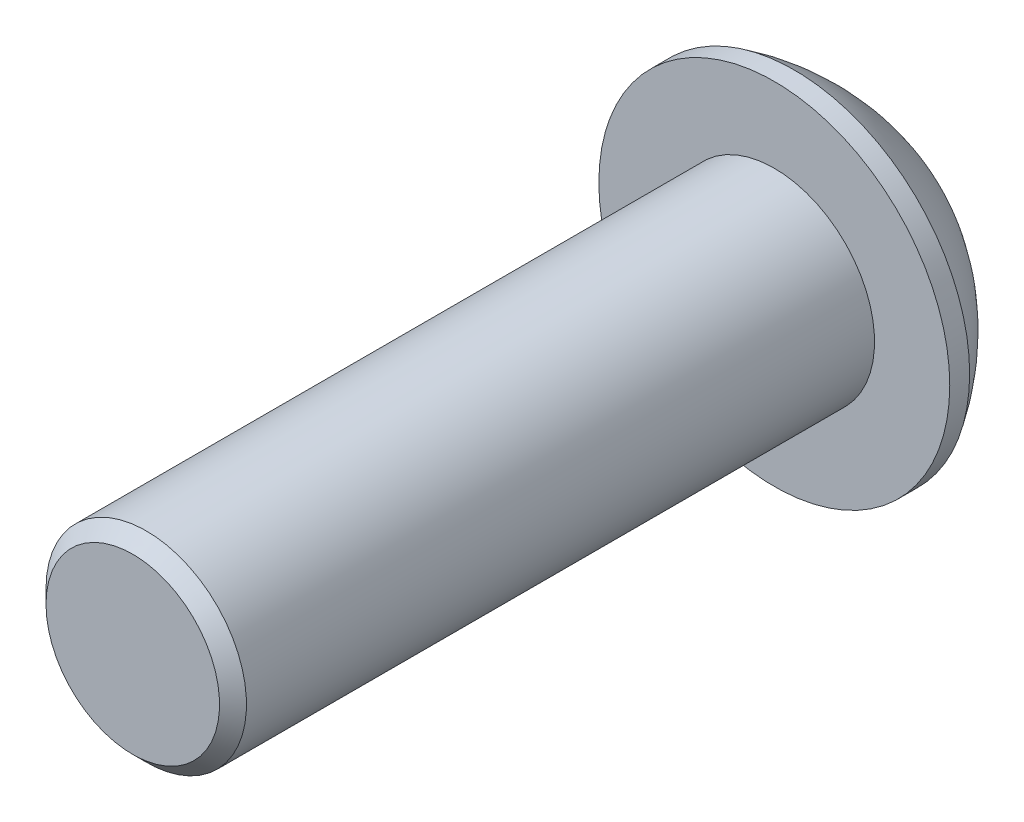
from build123d import *

# Parameters (mm, degrees)
CUT_EXTRUDE1_DEPTH = 3.175
CHAMFER1_SIZE      = 0.5334


with BuildPart() as part:
    # Sketch1 → Revolve1 (revolve)
    with BuildSketch(Plane(origin=(0, 0, 0), x_dir=(1, 0, 0), z_dir=(0, 1, 0)), mode=Mode.PRIVATE) as revolve1_sk:
        with BuildLine():
            Line((0, 0), (0, -25.4))
            Line((0, -25.4), (3.96875, -25.4))
            Line((3.96875, -25.4), (3.96875, 0))
            Line((3.96875, 0), (6.9469, 0))
            Line((6.9469, 0), (6.9469, 0.7874))
            ThreePointArc((6.9469, 0.7874), (5.294601142, 2.758916257), (3.175, 4.2164))
            Line((3.175, 4.2164), (0, 4.2164))
            Line((0, 4.2164), (0, 0))
        make_face()
    revolve(revolve1_sk.sketch.rotate(Axis((0, 0, 0), (0, 0, 1)), 180), axis=Axis((0, 0, 0), (0, 0, 1)))

    # Sketch2 → Cut-Extrude1 (cut)
    with BuildSketch(Plane(origin=(0, 0, -4.2164), x_dir=(-1, 0, 0), z_dir=(0, 0, -1))):
        Polygon((2.749630657, 0), (1.374815329, 2.38125), (-1.374815329, 2.38125), (-2.749630657, 0), (-1.374815329, -2.38125), (1.374815329, -2.38125), align=None)
    extrude(amount=-CUT_EXTRUDE1_DEPTH, mode=Mode.SUBTRACT)

    # Chamfer1
    chamfer1_edges = [part.edges().sort_by_distance(p)[0] for p in [
        (3.96875, 0, 25.4),
    ]]
    chamfer(chamfer1_edges, length=CHAMFER1_SIZE)


solid = part.part
